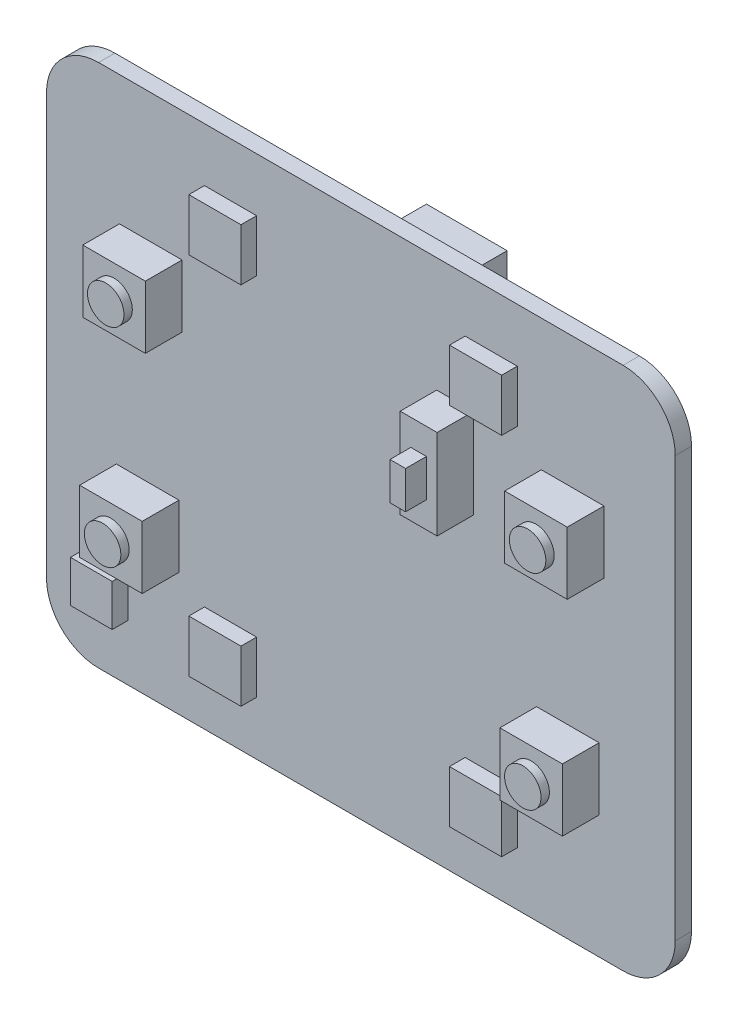
from build123d import *

# Parameters (mm, degrees)
PCB_DEPTH           = 1.56
ESQUISSE2_W         = 6
ESQUISSE2_H         = 6
CORPSBP_DEPTH       = 3.52
ESQUISSE2_3_R       = 1.75
BPBP_DEPTH          = 4.32
ESQUISSE2_4_W       = 3.54
ESQUISSE2_4_H       = 8.6
CORPSONOFF_DEPTH    = 3.5
ESQUISSE2_5_W       = 1.5
ESQUISSE2_5_H       = 3.6
BPONOFF_DEPTH       = 5.5
ESQUISSE2_6_W       = 5
ESQUISSE2_6_H       = 5
BOSS_EXTRU_9_DEPTH  = 1.5
ESQUISSE5_R         = 5.9
BUZZER_DEPTH        = 9.9
ESQUISSE5_4_W       = 7.74
ESQUISSE5_4_H       = 5
ISP_DEPTH           = 8.6
CR2032_DEPTH        = 7
ESQUISSE6_W         = 4
ESQUISSE6_H         = 4
BOSS_EXTRU_10_DEPTH = 1.5


with BuildPart() as part:
    # Esquisse1 → PCB (new body)
    with BuildSketch(Plane.XY):
        with BuildLine():
            Line((-25.15, -25.15), (25.15, -25.15))
            ThreePointArc((25.15, -25.15), (28.685533906, -23.685533906), (30.15, -20.15))
            Line((30.15, -20.15), (30.15, 20.15))
            ThreePointArc((30.15, 20.15), (28.685533906, 23.685533906), (25.15, 25.15))
            Line((25.15, 25.15), (-25.15, 25.15))
            ThreePointArc((-25.15, 25.15), (-28.685533906, 23.685533906), (-30.15, 20.15))
            Line((-30.15, 20.15), (-30.15, -20.15))
            ThreePointArc((-30.15, -20.15), (-28.685533906, -23.685533906), (-25.15, -25.15))
        make_face()
    extrude(amount=PCB_DEPTH)

    # Esquisse2 → CorpsBp (add)
    with BuildSketch(Plane.XY.offset(1.56)):
        with Locations((20.31, 9.55)):
            Rectangle(ESQUISSE2_W, ESQUISSE2_H)
        with Locations((19.85, -10.35)):
            Rectangle(ESQUISSE2_W, ESQUISSE2_H)
        with Locations((-20.45, -10.35)):
            Rectangle(ESQUISSE2_W, ESQUISSE2_H)
        with Locations((-20.15, 9.75)):
            Rectangle(ESQUISSE2_W, ESQUISSE2_H)
    extrude(amount=CORPSBP_DEPTH)

    # Esquisse2<3> → BpBp (add)
    with BuildSketch(Plane.XY.offset(1.56)):
        with Locations((20.31, 9.55)):
            Circle(ESQUISSE2_3_R)
        with Locations((-20.15, 9.75)):
            Circle(ESQUISSE2_3_R)
        with Locations((-20.45, -10.35)):
            Circle(ESQUISSE2_3_R)
        with Locations((19.85, -10.35)):
            Circle(ESQUISSE2_3_R)
    extrude(amount=BPBP_DEPTH)

    # Esquisse2<4> → CorpsOnOff (add)
    with BuildSketch(Plane.XY.offset(1.56)):
        with Locations((9.04, 9.85)):
            Rectangle(ESQUISSE2_4_W, ESQUISSE2_4_H)
    extrude(amount=CORPSONOFF_DEPTH)

    # Esquisse2<5> → BpOnOff (add)
    with BuildSketch(Plane.XY.offset(1.56)):
        with Locations((9.04, 9.85)):
            Rectangle(ESQUISSE2_5_W, ESQUISSE2_5_H)
    extrude(amount=BPONOFF_DEPTH)

    # Esquisse2<6> → Boss.-Extru.9 (add)
    with BuildSketch(Plane.XY.offset(1.56)):
        with Locations((-12.5, 17.5)):
            Rectangle(ESQUISSE2_6_W, ESQUISSE2_6_H)
        with Locations((-12.5, -17.5)):
            Rectangle(ESQUISSE2_6_W, ESQUISSE2_6_H)
        with Locations((12.5, -17.5)):
            Rectangle(ESQUISSE2_6_W, ESQUISSE2_6_H)
        with Locations((12.5, 17.5)):
            Rectangle(ESQUISSE2_6_W, ESQUISSE2_6_H)
    extrude(amount=BOSS_EXTRU_9_DEPTH)

    # Esquisse5 → Buzzer (add)
    with BuildSketch(Plane(origin=(0, 0, 0), x_dir=(-1, 0, 0), z_dir=(0, 0, -1))):
        with Locations((0.75, -18.69)):
            Circle(ESQUISSE5_R)
    extrude(amount=BUZZER_DEPTH)

    # Esquisse5<4> → ISP (add)
    with BuildSketch(Plane(origin=(0, 0, 0), x_dir=(-1, 0, 0), z_dir=(0, 0, -1))):
        with Locations((0, 16.45)):
            Rectangle(ESQUISSE5_4_W, ESQUISSE5_4_H)
    extrude(amount=ISP_DEPTH)

    # Esquisse5<5> → CR2032 (add)
    with BuildSketch(Plane(origin=(0, 0, 0), x_dir=(-1, 0, 0), z_dir=(0, 0, -1))):
        with BuildLine():
            Line((9.061920088, 3.25), (15.15, 3.25))
            Line((15.15, 3.25), (15.15, -3.35))
            Line((15.15, -3.35), (9.061920088, -3.35))
            ThreePointArc((9.061920088, -3.35), (-13.25, -0.05), (9.061920088, 3.25))
        make_face()
    extrude(amount=CR2032_DEPTH)

    # Esquisse6 → Boss.-Extru.10 (add)
    with BuildSketch(Plane.XY.offset(1.56)):
        with Locations((-24.35, -17.8)):
            Rectangle(ESQUISSE6_W, ESQUISSE6_H)
    extrude(amount=BOSS_EXTRU_10_DEPTH)


solid = part.part
